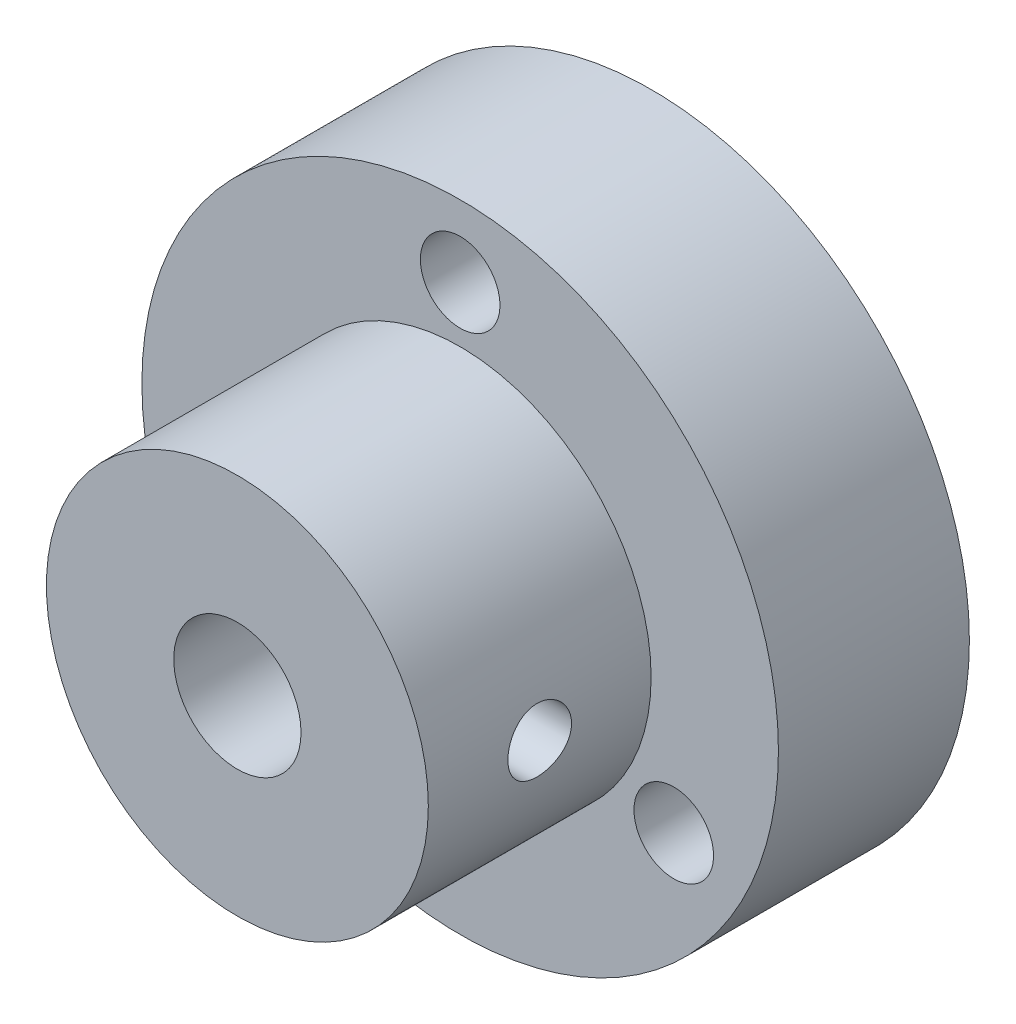
from build123d import *

# Parameters (mm, degrees)
SKETCH1_R               = 20
BOSS_EXTRUDE1_DEPTH     = 12
SKETCH1_3_R             = 12
BOSS_EXTRUDE2_DEPTH     = 26
CUT_EXTRUDE1_DEPTH      = 39.418745425
CUT_EXTRUDE1_DEPTH_BACK = 39.418745425
SKETCH1_4_R             = 4
CUT_EXTRUDE2_DEPTH      = 39.418745425
CUT_EXTRUDE2_DEPTH_BACK = 39.418745425
SKETCH2_R               = 2
CUT_EXTRUDE3_START      = -26
SKETCH3_R               = 2.5
CUT_EXTRUDE3_DEPTH      = 58.55946772
CIRPATTERN1_COUNT       = 3


with BuildPart() as part:
    # Sketch1 → Boss-Extrude1 (new body)
    with BuildSketch(Plane.XY):
        Circle(SKETCH1_R)
    extrude(amount=BOSS_EXTRUDE1_DEPTH)

    # Sketch1<3> → Boss-Extrude2 (add)
    with BuildSketch(Plane.XY):
        Circle(SKETCH1_3_R)
    extrude(amount=BOSS_EXTRUDE2_DEPTH)

    # Sketch1<4> → Cut-Extrude1 (cut, two sides: drawn at the far end of the back side and taken through both)
    with BuildSketch(Plane.XY.offset(-CUT_EXTRUDE1_DEPTH_BACK)):
        Circle(SKETCH1_4_R)
    extrude(amount=CUT_EXTRUDE1_DEPTH + CUT_EXTRUDE1_DEPTH_BACK, mode=Mode.SUBTRACT)

    # Sketch2 → Cut-Extrude2 (cut, two sides: drawn at the far end of the back side and taken through both)
    with BuildSketch(Plane(origin=(0, 0, 0), x_dir=(0, 0, -1), z_dir=(1, 0, 0)).offset(-CUT_EXTRUDE2_DEPTH_BACK)):
        with Locations((-19, 0)):
            Circle(SKETCH2_R)
    extrude(amount=CUT_EXTRUDE2_DEPTH + CUT_EXTRUDE2_DEPTH_BACK, mode=Mode.SUBTRACT)

    # Sketch3 → Cut-Extrude3 (cut)
    with BuildSketch(Plane.XY.offset(12).offset(CUT_EXTRUDE3_START)):
        with Locations((0, 15.5)):
            Circle(SKETCH3_R)
    cut_extrude3 = extrude(amount=CUT_EXTRUDE3_DEPTH, mode=Mode.SUBTRACT)

    # CirPattern1: Cut-Extrude3 ×3 about axis
    cirpattern1_axis = Axis((0, 0, 26), (0, 0, -1))
    for i in range(1, CIRPATTERN1_COUNT):
        add(cut_extrude3.rotate(cirpattern1_axis, i * 360 / CIRPATTERN1_COUNT), mode=Mode.SUBTRACT)


solid = part.part
